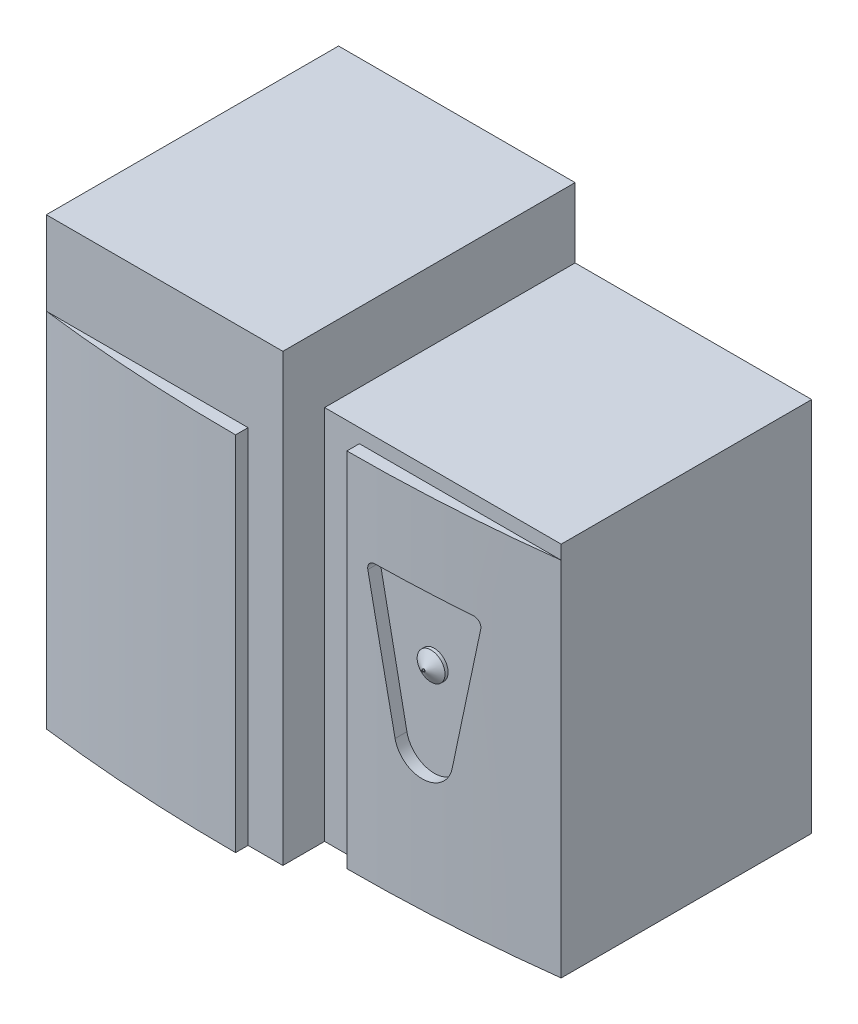
from build123d import *

# Parameters (mm, degrees)
SKETCH1_W           = 431.8
SKETCH1_H           = 457.2
BOSS_EXTRUDE1_DEPTH = 685.8
SKETCH2_W           = 431.8
SKETCH2_H           = 533.4
BOSS_EXTRUDE2_DEPTH = 812.8
BOSS_EXTRUDE4_DEPTH = 660.4
BOSS_EXTRUDE3_DEPTH = 660.4
CUT_EXTRUDE3_DEPTH  = 76.2
SKETCH7_R           = 25.4
BOSS_EXTRUDE5_DEPTH = 19.05
CHAMFER1_SIZE       = 13.335
CHAMFER1_SIZE2      = 23.096897519
SKETCH8_R           = 1.5875
SKETCH8_R_2         = 0.635
BOSS_EXTRUDE6_DEPTH = 2.54


with BuildPart() as part:
    # Sketch1 → Boss-Extrude1 (new body)
    with BuildSketch(Plane(origin=(0, 0, 0), x_dir=(1, 0, 0), z_dir=(0, 1, 0))):
        Rectangle(SKETCH1_W, SKETCH1_H)
    extrude(amount=BOSS_EXTRUDE1_DEPTH)

    # Sketch2 → Boss-Extrude2 (add)
    with BuildSketch(Plane(origin=(0, 0, 0), x_dir=(1, 0, 0), z_dir=(0, 1, 0))):
        with Locations((-431.8, -38.1)):
            Rectangle(SKETCH2_W, SKETCH2_H)
    extrude(amount=BOSS_EXTRUDE2_DEPTH)

    # Sketch4 → Boss-Extrude4 (add)
    with BuildSketch(Plane(origin=(0, 0, 0), x_dir=(1, 0, 0), z_dir=(0, 1, 0))):
        with BuildLine():
            Line((-152.4, -251.46), (-152.4, -228.6))
            Line((-152.4, -228.6), (215.9, -228.6))
            ThreePointArc((215.9, -228.6), (32.104383146, -245.739506237), (-152.4, -251.46))
        make_face()
    extrude(amount=BOSS_EXTRUDE4_DEPTH)

    # Sketch3 → Boss-Extrude3 (add)
    with BuildSketch(Plane(origin=(0, 0, 0), x_dir=(1, 0, 0), z_dir=(0, 1, 0))):
        with BuildLine():
            Line((-279.4, -304.8), (-279.4, -327.66))
            ThreePointArc((-279.4, -327.66), (-463.904383146, -321.939506237), (-647.7, -304.8))
            Line((-647.7, -304.8), (-279.4, -304.8))
        make_face()
    extrude(amount=BOSS_EXTRUDE3_DEPTH)

    # Sketch6 → Cut-Extrude3 (cut)
    with BuildSketch(Plane.XY.offset(304.8)):
        with BuildLine():
            Line((33.909716126, 248.55832752), (82.654926159, 491.804601993))
            ThreePointArc((82.654926159, 491.804601993), (80.025469047, 502.349796436), (70.202497127, 507))
            Line((70.202497127, 507), (-102.002497127, 507))
            ThreePointArc((-102.002497127, 507), (-111.825469047, 502.349796436), (-114.454926159, 491.804601993))
            Line((-114.454926159, 491.804601993), (-65.709716126, 248.55832752))
            ThreePointArc((-65.709716126, 248.55832752), (-15.9, 207.739919548), (33.909716126, 248.55832752))
        make_face()
    extrude(amount=-CUT_EXTRUDE3_DEPTH, mode=Mode.SUBTRACT)



with BuildPart() as body_2:
    # Sketch7 → Boss-Extrude5 (new body)
    with BuildSketch(Plane.XY.offset(228.6)):
        with Locations(Location((-15.9, 380, 0), (0, 0, 180))):
            Circle(SKETCH7_R)
    extrude(amount=BOSS_EXTRUDE5_DEPTH)

    # Chamfer1
    chamfer1_edges = [body_2.edges().sort_by_distance(p)[0] for p in [
        (9.5, 380, 247.65),
    ]]
    chamfer1_side = [body_2.faces().sort_by_distance(p)[0] for p in [
        (9.5, 380, 238.125),
    ]]
    chamfer(chamfer1_edges, length=CHAMFER1_SIZE, length2=CHAMFER1_SIZE2, reference=chamfer1_side[0])


with BuildPart() as part_1:
    add(part.part)

    add(body_2.part)  # Boss-Extrude6 merges body 2
    # Sketch8 → Boss-Extrude6 (add)
    with BuildSketch(Plane.XY.offset(247.65)):
        with Locations((-15.9, 380)):
            Circle(SKETCH8_R)
        with Locations((-15.9, 380)):
            Circle(SKETCH8_R_2, mode=Mode.SUBTRACT)
    extrude(amount=BOSS_EXTRUDE6_DEPTH)


solid = part_1.part
